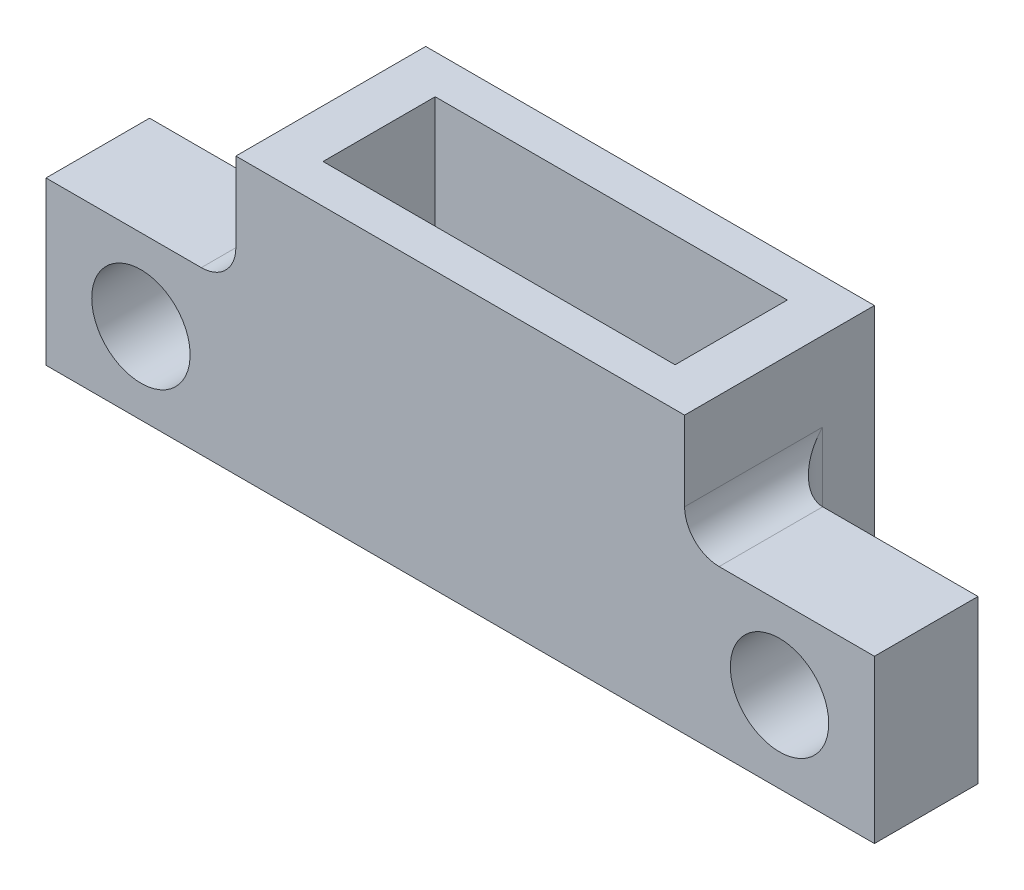
from build123d import *

# Parameters (mm, degrees)
SKETCH2_W           = 26
SKETCH2_H           = 11
SKETCH2_W_2         = 20.4
SKETCH2_H_2         = 6.5
BOSS_EXTRUDE1_DEPTH = 10
SKETCH3_W           = 26
SKETCH3_H           = 11
SKETCH3_W_2         = 2.5
SKETCH3_H_2         = 6.5
BOSS_EXTRUDE2_DEPTH = 6
SKETCH4_W           = 11
SKETCH4_H           = 9.4
SKETCH4_R           = 2.85
BOSS_EXTRUDE3_DEPTH = 6
FILLET1_R           = 2


with BuildPart() as part:
    # Sketch2 → Boss-Extrude1 (new body)
    with BuildSketch(Plane(origin=(0, 0, 0), x_dir=(1, 0, 0), z_dir=(0, 1, 0))):
        Rectangle(SKETCH2_W, SKETCH2_H)
        Rectangle(SKETCH2_W_2, SKETCH2_H_2, mode=Mode.SUBTRACT)
    extrude(amount=BOSS_EXTRUDE1_DEPTH)

    # Sketch3 → Boss-Extrude2 (add)
    with BuildSketch(Plane.XZ):
        Rectangle(SKETCH3_W, SKETCH3_H)
        with Locations((-7.45, 0)):
            Rectangle(SKETCH3_W_2, SKETCH3_H_2, mode=Mode.SUBTRACT)
        with Locations((-0.25, 0)):
            Rectangle(SKETCH3_W_2, SKETCH3_H_2, mode=Mode.SUBTRACT)
        with Locations((7.45, 0)):
            Rectangle(SKETCH3_W_2, SKETCH3_H_2, mode=Mode.SUBTRACT)
    extrude(amount=BOSS_EXTRUDE2_DEPTH)

    # Sketch4 → Boss-Extrude3 (add)
    # profile 1 of 2: a face of its own
    with BuildSketch(Plane.XY.offset(5.5)):
        with Locations((18.5, -1.3)):
            Rectangle(SKETCH4_W, SKETCH4_H)
        with Locations((18.5, -1.3)):
            Circle(SKETCH4_R, mode=Mode.SUBTRACT)
    # profile 2 of 2: a face of its own
    with BuildSketch(Plane.XY.offset(5.5)):
        with Locations((-18.5, -1.3)):
            Rectangle(SKETCH4_W, SKETCH4_H)
        with Locations(Location((-18.5, -1.3, 0), (0, 0, 180))):
            Circle(SKETCH4_R, mode=Mode.SUBTRACT)
    extrude(amount=-BOSS_EXTRUDE3_DEPTH)

    # Fillet1
    fillet1_edges = [part.edges().sort_by_distance(p)[0] for p in [
        (13, -1.3, -0.5),
        (13, 3.4, 2.5),
        (-13, -1.3, -0.5),
        (-13, 3.4, 2.5),
    ]]
    fillet(fillet1_edges, radius=FILLET1_R)


solid = part.part
